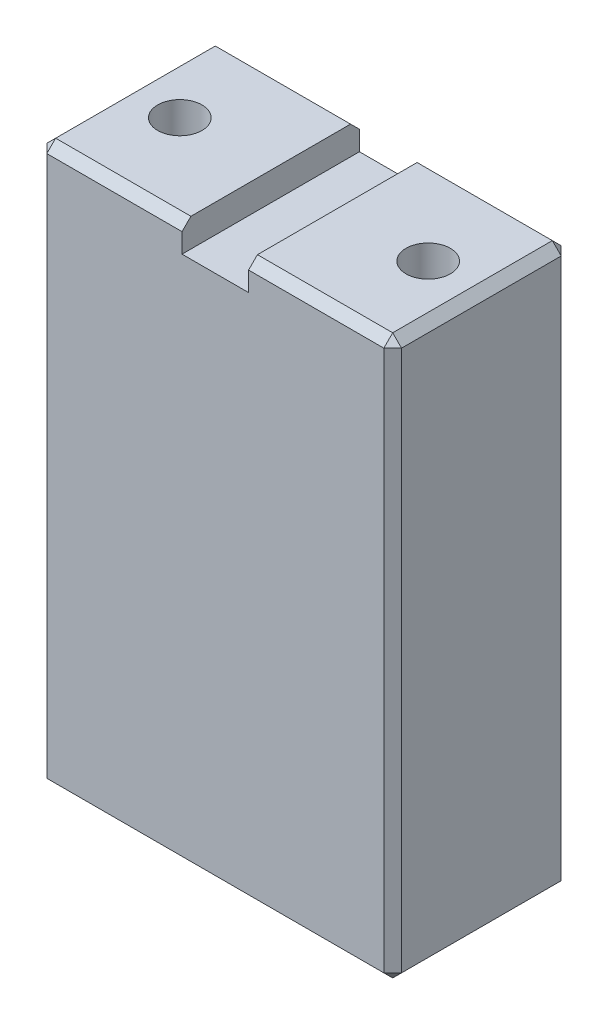
from build123d import *

# Parameters (mm, degrees)
SKETCH1_W             = 40
SKETCH1_H             = 63
BOSS_EXTRUDE1_DEPTH   = 20
SKETCH2_W             = 7.5
SKETCH2_H             = 20
CUT_EXTRUDE1_DEPTH    = 3.2
M8_TAPPED_HOLE1_D     = 6.8
M8_TAPPED_HOLE1_DEPTH = 19.75
M8_TAPPED_HOLE1_TIP   = 2.042926105
M6_TAPPED_HOLE1_D     = 5
M6_TAPPED_HOLE1_DEPTH = 15
M6_TAPPED_HOLE1_TIP   = 1.502151548
CHAMFER1_SIZE         = 1


with BuildPart() as part:
    # Sketch1 → Boss-Extrude1 (new body)
    with BuildSketch(Plane.XY):
        Rectangle(SKETCH1_W, SKETCH1_H)
    extrude(amount=BOSS_EXTRUDE1_DEPTH)

    # Sketch2 → Cut-Extrude1 (cut)
    with BuildSketch(Plane(origin=(0, 31.5, 0), x_dir=(1, 0, 0), z_dir=(0, 1, 0))):
        with Locations((0, -10)):
            Rectangle(SKETCH2_W, SKETCH2_H)
    extrude(amount=-CUT_EXTRUDE1_DEPTH, mode=Mode.SUBTRACT)

    # M8 Tapped Hole1
    with Locations(Plane(origin=(0, -31.5, 0), x_dir=(-1, 0, 0), z_dir=(0, -1, 0))):
        with Locations((-12, -10), (12, -10)):
            Hole(M8_TAPPED_HOLE1_D / 2, depth=M8_TAPPED_HOLE1_DEPTH)
            with Locations((0, 0, -(M8_TAPPED_HOLE1_DEPTH + M8_TAPPED_HOLE1_TIP / 2))):  # 118° drill point
                Cone(0, M8_TAPPED_HOLE1_D / 2, M8_TAPPED_HOLE1_TIP, mode=Mode.SUBTRACT)

    # M6 Tapped Hole1
    with Locations(Plane(origin=(0, 31.5, 0), x_dir=(1, 0, 0), z_dir=(0, 1, 0))):
        with Locations((-14, -10), (14, -10)):
            Hole(M6_TAPPED_HOLE1_D / 2, depth=M6_TAPPED_HOLE1_DEPTH)
            with Locations((0, 0, -(M6_TAPPED_HOLE1_DEPTH + M6_TAPPED_HOLE1_TIP / 2))):  # 118° drill point
                Cone(0, M6_TAPPED_HOLE1_D / 2, M6_TAPPED_HOLE1_TIP, mode=Mode.SUBTRACT)

    # Chamfer1
    chamfer1_edges = [part.edges().sort_by_distance(p)[0] for p in [
        (-20, 0, 20),
        (-11.875, 31.5, 0),
        (0, -31.5, 20),
        (-11.875, 31.5, 20),
        (20, 0, 20),
        (0, -31.5, 0),
        (-20, 0, 0),
        (11.875, 31.5, 0),
        (20, 0, 0),
        (20, -31.5, 10),
        (-20, -31.5, 10),
        (-20, 31.5, 10),
        (20, 31.5, 10),
        (11.875, 31.5, 20),
    ]]
    chamfer(chamfer1_edges, length=CHAMFER1_SIZE)


solid = part.part
